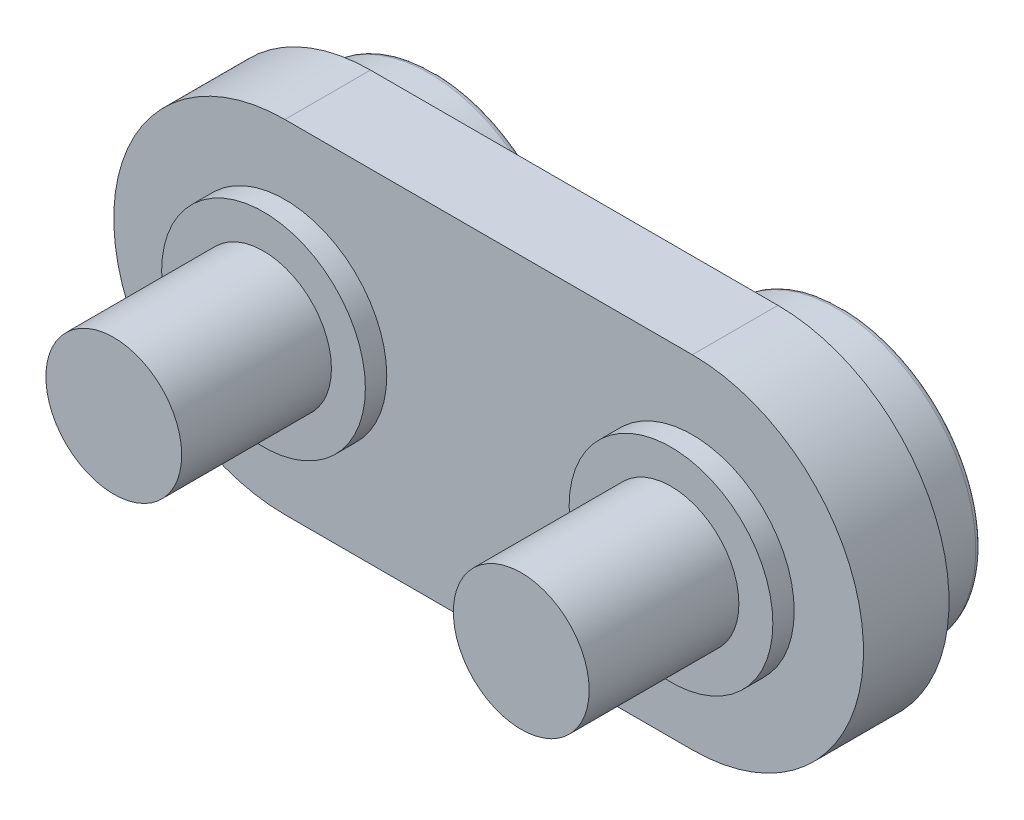
from build123d import *

# Parameters (mm, degrees)
SKETCH1_R             = 2.11
BOSS_EXTRUDE1_DEPTH   = 4
SKETCH2_R             = 6.5
SKETCH2_R_2           = 2.11
BOSS_EXTRUDE2_DEPTH   = 3
BOSS_EXTRUDE2_2_DEPTH = 3
FILLET1_R             = 0.25
CHAMFER1_SIZE         = 1
CHAMFER1_SIZE2        = 0.577350269
SKETCH3_R             = 4.7625
SKETCH3_R_2           = 2.11
BOSS_EXTRUDE3_DEPTH   = 1
BOSS_EXTRUDE3_2_DEPTH = 1
SKETCH4_R             = 3.175
BOSS_EXTRUDE4_DEPTH   = 7
BOSS_EXTRUDE4_2_DEPTH = 7
FILLET2_R             = 0.25
CHAMFER2_SIZE         = 1
CHAMFER2_SIZE2        = 0.577350269


with BuildPart() as part:
    # Sketch1 → Boss-Extrude1 (new body)
    with BuildSketch(Plane.XY):
        with BuildLine():
            Line((-9.525, 8), (9.525, 8))
            ThreePointArc((9.525, 8), (17.525, 0), (9.525, -8))
            Line((9.525, -8), (-9.525, -8))
            ThreePointArc((-9.525, -8), (-17.525, 0), (-9.525, 8))
        make_face()
        with Locations((-9.525, 0)):
            Circle(SKETCH1_R, mode=Mode.SUBTRACT)
        with Locations((9.525, 0)):
            Circle(SKETCH1_R, mode=Mode.SUBTRACT)
    extrude(amount=BOSS_EXTRUDE1_DEPTH)


with BuildPart() as body_2:
    # Sketch2 → Boss-Extrude2 (new body)
    with BuildSketch(Plane(origin=(0, 0, 0), x_dir=(-1, 0, 0), z_dir=(0, 0, -1))):
        with Locations((-9.525, 0)):
            Circle(SKETCH2_R)
        with Locations((-9.525, 0)):
            Circle(SKETCH2_R_2, mode=Mode.SUBTRACT)
    extrude(amount=BOSS_EXTRUDE2_DEPTH)

    # Fillet2
    fillet2_edges = [body_2.edges().sort_by_distance(p)[0] for p in [
        (16.025, 0, -3),
    ]]
    fillet(fillet2_edges, radius=FILLET2_R)

    # Chamfer2
    chamfer2_edges = [body_2.edges().sort_by_distance(p)[0] for p in [
        (11.635, 0, -3),
    ]]
    chamfer2_side = [body_2.faces().sort_by_distance(p)[0] for p in [
        (15.598223305, 0, -3),
    ]]
    chamfer(chamfer2_edges, length=CHAMFER2_SIZE, length2=CHAMFER2_SIZE2, reference=chamfer2_side[0])


with BuildPart() as body_3:
    # Sketch2 → Boss-Extrude2 2 (new body)
    with BuildSketch(Plane(origin=(0, 0, 0), x_dir=(-1, 0, 0), z_dir=(0, 0, -1))):
        with Locations((9.525, 0)):
            Circle(SKETCH2_R)
        with Locations((9.525, 0)):
            Circle(SKETCH2_R_2, mode=Mode.SUBTRACT)
    extrude(amount=BOSS_EXTRUDE2_2_DEPTH)

    # Fillet1
    fillet1_edges = [body_3.edges().sort_by_distance(p)[0] for p in [
        (-3.025, 0, -3),
    ]]
    fillet(fillet1_edges, radius=FILLET1_R)

    # Chamfer1
    chamfer1_edges = [body_3.edges().sort_by_distance(p)[0] for p in [
        (-7.415, 0, -3),
    ]]
    chamfer1_side = [body_3.faces().sort_by_distance(p)[0] for p in [
        (-3.451776695, 0, -3),
    ]]
    chamfer(chamfer1_edges, length=CHAMFER1_SIZE, length2=CHAMFER1_SIZE2, reference=chamfer1_side[0])


with BuildPart() as body_4:
    # Sketch3 → Boss-Extrude3 (new body)
    with BuildSketch(Plane.XY.offset(4)):
        with Locations((-9.525, 0)):
            Circle(SKETCH3_R)
        with Locations((-9.525, 0)):
            Circle(SKETCH3_R_2, mode=Mode.SUBTRACT)
    extrude(amount=BOSS_EXTRUDE3_DEPTH)


with BuildPart() as body_5:
    # Sketch3 → Boss-Extrude3 2 (new body)
    with BuildSketch(Plane.XY.offset(4)):
        with Locations((9.525, 0)):
            Circle(SKETCH3_R)
        with Locations((9.525, 0)):
            Circle(SKETCH3_R_2, mode=Mode.SUBTRACT)
    extrude(amount=BOSS_EXTRUDE3_2_DEPTH)


with BuildPart() as body_6:
    # Sketch4 → Boss-Extrude4 (new body)
    with BuildSketch(Plane.XY.offset(5)):
        with Locations((-9.525, 0)):
            Circle(SKETCH4_R)
    extrude(amount=BOSS_EXTRUDE4_DEPTH)


with BuildPart() as body_7:
    # Sketch4 → Boss-Extrude4 2 (new body)
    with BuildSketch(Plane.XY.offset(5)):
        with Locations((9.525, 0)):
            Circle(SKETCH4_R)
    extrude(amount=BOSS_EXTRUDE4_2_DEPTH)


solid = Compound([part.part, body_2.part, body_3.part, body_4.part, body_5.part, body_6.part, body_7.part])
